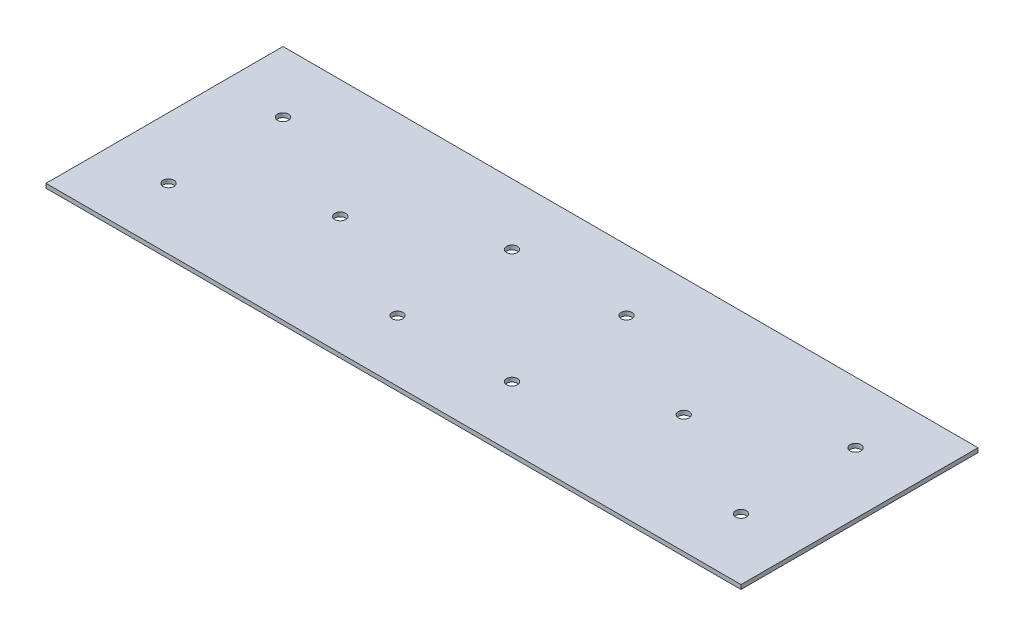
from build123d import *

# Parameters (mm, degrees)
SKETCH1_W           = 261
SKETCH1_H           = 89
BOSS_EXTRUDE1_DEPTH = 1.6
SKETCH3_R           = 2.05
CUT_EXTRUDE1_DEPTH  = 276.761781253


with BuildPart() as part:
    # Sketch1 → Boss-Extrude1 (new body)
    with BuildSketch(Plane(origin=(0, 0, 0), x_dir=(1, 0, 0), z_dir=(0, 1, 0))):
        with Locations((130.5, 44.5)):
            Rectangle(SKETCH1_W, SKETCH1_H)
    extrude(amount=BOSS_EXTRUDE1_DEPTH)

    # Sketch3 → Cut-Extrude1 (cut, through all)
    with BuildSketch(Plane(origin=(0, 1.6, 0), x_dir=(1, 0, 0), z_dir=(0, 1, 0))):
        with Locations(Location((23, 66, 0), (0, 0, 270))):
            Circle(SKETCH3_R)
        with Locations(Location((23, 23, 0), (0, 0, 270))):
            Circle(SKETCH3_R)
        with Locations(Location((66, 44.5, 0), (0, 0, 270))):
            Circle(SKETCH3_R)
        with Locations(Location((109, 66, 0), (0, 0, 270))):
            Circle(SKETCH3_R)
        with Locations(Location((109, 23, 0), (0, 0, 270))):
            Circle(SKETCH3_R)
        with Locations(Location((152, 23, 0), (0, 0, 270))):
            Circle(SKETCH3_R)
        with Locations(Location((152, 66, 0), (0, 0, 270))):
            Circle(SKETCH3_R)
        with Locations(Location((195, 44.5, 0), (0, 0, 270))):
            Circle(SKETCH3_R)
        with Locations(Location((238, 66, 0), (0, 0, 270))):
            Circle(SKETCH3_R)
        with Locations(Location((238, 23, 0), (0, 0, 270))):
            Circle(SKETCH3_R)
    extrude(amount=-CUT_EXTRUDE1_DEPTH, mode=Mode.SUBTRACT)


solid = part.part
